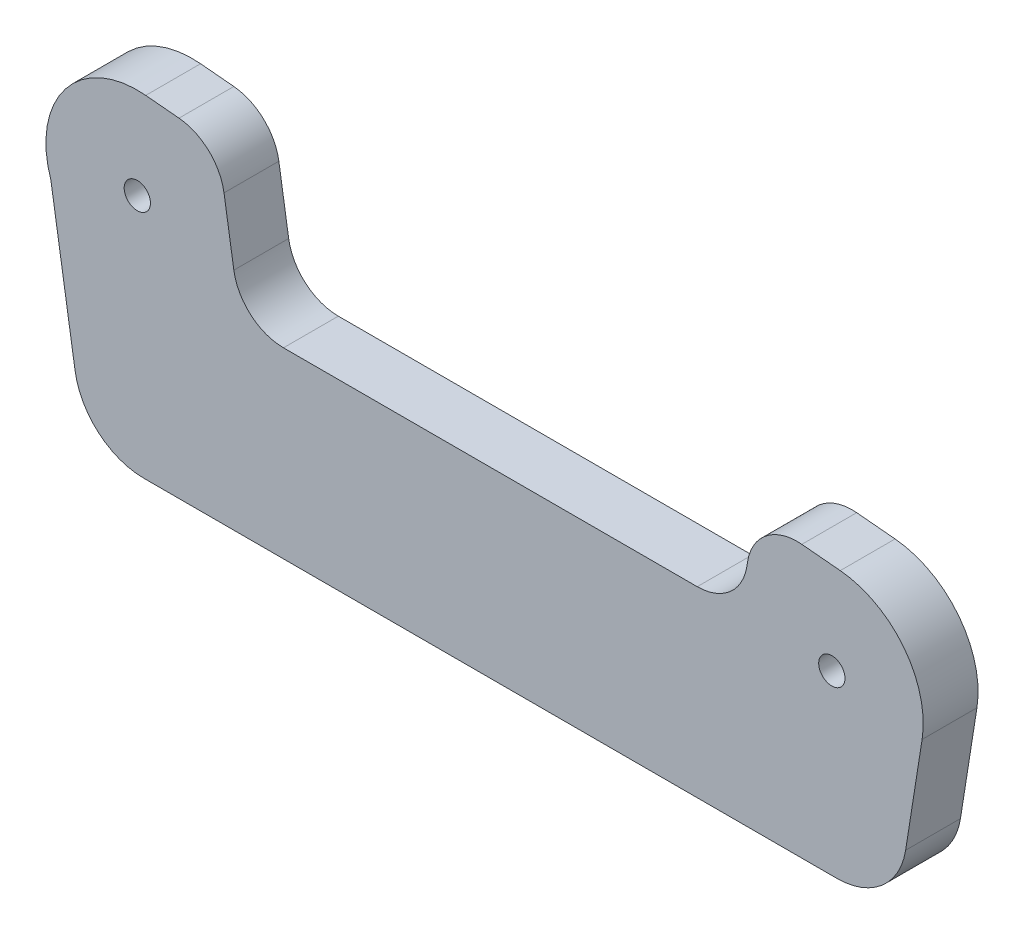
from build123d import *

# Parameters (mm, degrees)
SKETCH1_R           = 1.4375
BOSS_EXTRUDE1_DEPTH = 5.999988
FILLET3_R           = 7.62
CUT_EXTRUDE2_DEPTH  = 91.763371988
FILLET5_R           = 5.5


with BuildPart() as part:
    # Sketch1 → Boss-Extrude1 (new body)
    # profile 1 of 2: a face of its own
    with BuildSketch(Plane.XY):
        with BuildLine():
            Line((-12.524548321, 23.175850862), (-8.858779162, 0))
            Line((-8.858779162, 0), (79.974319043, 0))
            Line((79.974319043, 0), (82.794220418, 17.828076701))
            ThreePointArc((82.794220418, 17.828076701), (80.81199482, 25.527902595), (73.838835056, 29.347795267))
            Line((73.838835056, 29.347795267), (-2.145190776, 36.382122067))
            ThreePointArc((-2.145190776, 36.382122067), (4.322784828, 33.16197662), (6.932987084, 26.424700516))
            ThreePointArc((6.932987084, 26.424700516), (6.181465859, 22.621328283), (4.039859015, 19.389619041))
            ThreePointArc((4.039859015, 19.389619041), (3.875471285, 19.227345924), (3.707379331, 19.06891302))
            ThreePointArc((3.707379331, 19.06891302), (-5.519878365, 16.730194284), (-12.524548321, 23.175850862))
        make_face()
        with Locations((72.917012916, 19.390373716)):
            Circle(SKETCH1_R, mode=Mode.SUBTRACT)
    # profile 2 of 2: a face of its own
    with BuildSketch(Plane.XY):
        with BuildLine():
            ThreePointArc((-2.145190776, 36.382122067), (-10.929328098, 32.604020866), (-12.524548321, 23.175850862))
            ThreePointArc((-12.524548321, 23.175850862), (-5.519878365, 16.730194284), (3.707379331, 19.06891302))
            ThreePointArc((3.707379331, 19.06891302), (3.875471285, 19.227345924), (4.039859015, 19.389619041))
            ThreePointArc((4.039859015, 19.389619041), (6.181465859, 22.621328283), (6.932987084, 26.424700516))
            ThreePointArc((6.932987084, 26.424700516), (4.322784828, 33.16197662), (-2.145190776, 36.382122067))
        make_face()
        with Locations((-3.067012916, 26.424700516)):
            Circle(SKETCH1_R, mode=Mode.SUBTRACT)
    extrude(amount=BOSS_EXTRUDE1_DEPTH)

    # Fillet3
    fillet3_edges = [part.edges().sort_by_distance(p)[0] for p in [
        (79.974319043, 0, 2.999994),
        (-8.858779162, 0, 2.999994),
    ]]
    fillet(fillet3_edges, radius=FILLET3_R)

    # Sketch3 → Cut-Extrude2 (cut, through all)
    with BuildSketch(Plane.XY.offset(5.999988)):
        Polygon((5.750849923, 35.651135125), (8.226420239, 20), (62.889119642, 20), (64.504363049, 30.211946987), align=None)
    extrude(amount=-CUT_EXTRUDE2_DEPTH, mode=Mode.SUBTRACT)

    # Fillet5
    fillet5_edges = [part.edges().sort_by_distance(p)[0] for p in [
        (5.750849923, 35.651135125, 2.999994),
        (64.504363049, 30.211946987, 2.999994),
        (62.889119642, 20, 2.999994),
        (8.226420239, 20, 2.999994),
    ]]
    fillet(fillet5_edges, radius=FILLET5_R)


solid = part.part
